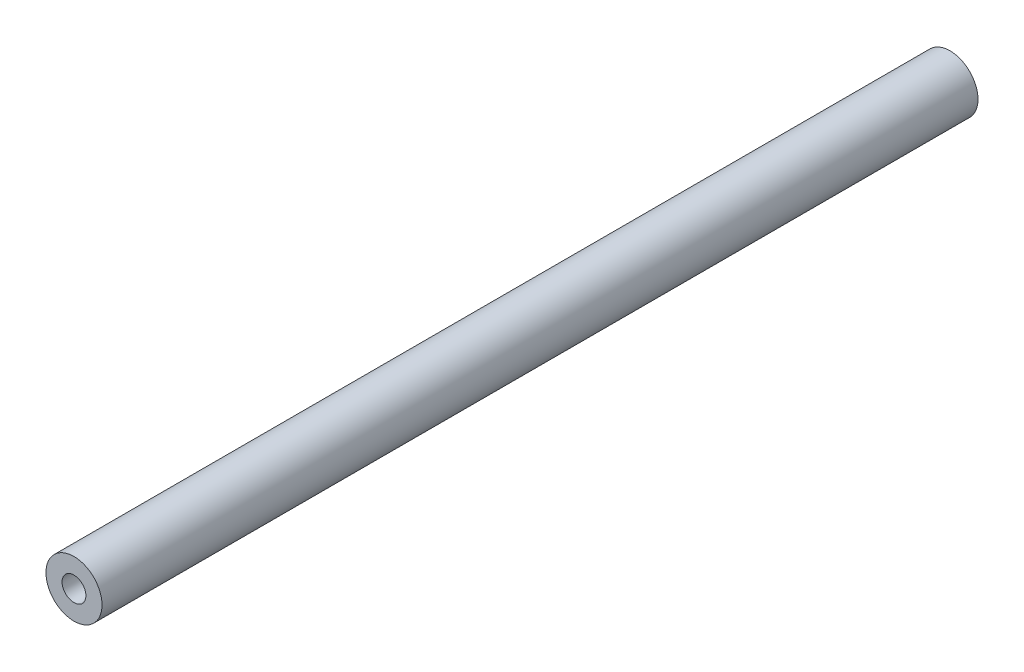
from build123d import *

# Parameters (mm, degrees)
SKETCH_1_R             = 8
EXTRUDE_1_DEPTH        = 250
HOLE_WIZARD_M8_2_D     = 6.8
HOLE_WIZARD_M8_2_DEPTH = 26.25
HOLE_WIZARD_M8_2_TIP   = 2.042926105


with BuildPart() as part:
    # 草图1 → 凸台-拉伸1 (new body)
    with BuildSketch(Plane.XY):
        Circle(SKETCH_1_R)
    extrude(amount=EXTRUDE_1_DEPTH)

    # 草图5 → M8 螺纹孔1 (revolve, cut)
    with BuildSketch(Plane(origin=(0, 0, 250), x_dir=(0, -1, 0), z_dir=(1, 0, 0))):
        Polygon((0, 0), (0, 28.292926105), (3.4, 26.25), (3.4, 0), align=None)
    revolve(axis=Axis((0, 0, 256.35), (0, 0, -1)), mode=Mode.SUBTRACT)

    # M8 螺纹孔2
    with Locations(Plane(origin=(0, 0, 0), x_dir=(-1, 0, 0), z_dir=(0, 0, -1))):
        with Locations((0, 0)):
            Hole(HOLE_WIZARD_M8_2_D / 2, depth=HOLE_WIZARD_M8_2_DEPTH)
            with Locations((0, 0, -(HOLE_WIZARD_M8_2_DEPTH + HOLE_WIZARD_M8_2_TIP / 2))):  # 118° drill point
                Cone(0, HOLE_WIZARD_M8_2_D / 2, HOLE_WIZARD_M8_2_TIP, mode=Mode.SUBTRACT)


solid = part.part
